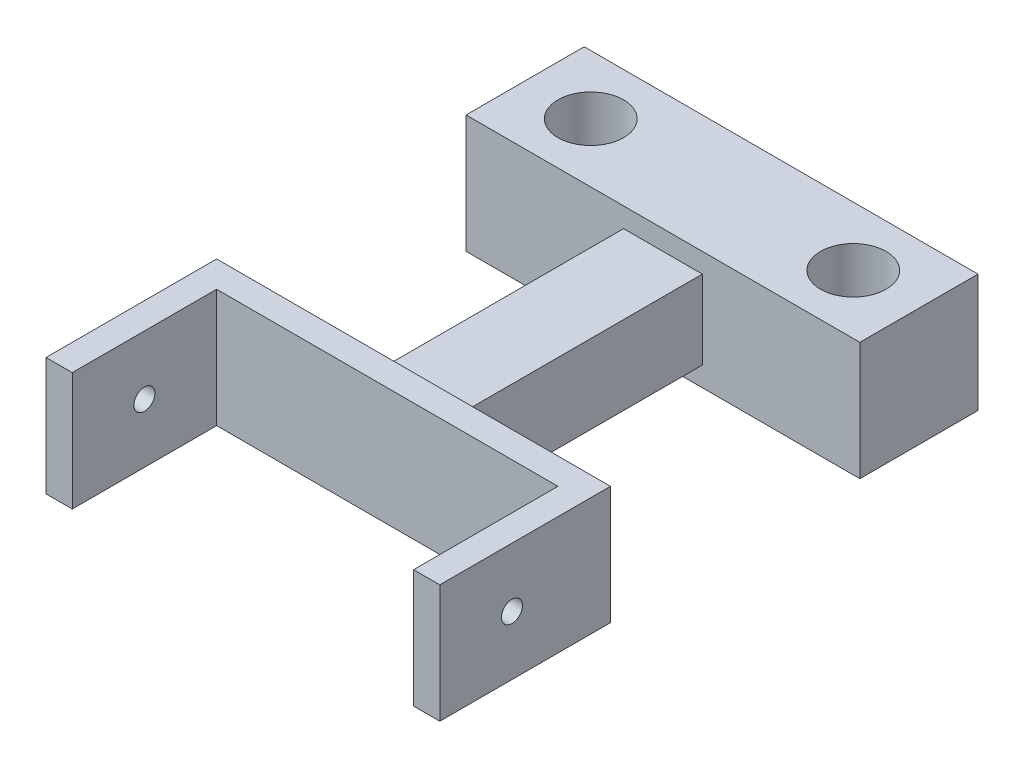
from build123d import *

# Parameters (mm, degrees)
SKETCH_1_W               = 150
SKETCH_1_H               = 45
EXTRUDE_1_DEPTH          = 45
CUT_EXTRUDE_1_DEPTH      = 91.311959341
CUT_EXTRUDE_1_DEPTH_BACK = 91.311959341
SKETCH_2_R               = 12.5
SKETCH_3_W               = 30
SKETCH_3_H               = 30
EXTRUDE_2_DEPTH          = 95
EXTRUDE_3_DEPTH          = 22.5
CUT_EXTRUDE_2_DEPTH      = 179.132675273
CUT_EXTRUDE_2_DEPTH_BACK = 179.132675273
SKETCH_5_R               = 4


with BuildPart() as part:
    # 草图1 → 凸台-拉伸1 (new body)
    with BuildSketch(Plane.XY):
        Rectangle(SKETCH_1_W, SKETCH_1_H)
    extrude(amount=-EXTRUDE_1_DEPTH)

    # 草图2 → 切除-拉伸1 (cut, two sides: drawn at the far end of the back side and taken through both)
    with BuildSketch(Plane(origin=(0, 0, 0), x_dir=(1, 0, 0), z_dir=(0, 1, 0)).offset(-CUT_EXTRUDE_1_DEPTH_BACK)):
        with Locations(Location((-50, 22.5, 0), (0, 0, 270))):
            Circle(SKETCH_2_R)
        with Locations(Location((50, 22.5, 0), (0, 0, 270))):
            Circle(SKETCH_2_R)
    extrude(amount=CUT_EXTRUDE_1_DEPTH + CUT_EXTRUDE_1_DEPTH_BACK, mode=Mode.SUBTRACT)

    # 草图3 → 凸台-拉伸2 (add)
    with BuildSketch(Plane.XY):
        Rectangle(SKETCH_3_W, SKETCH_3_H)
    extrude(amount=EXTRUDE_2_DEPTH)

    # 草图4 → 凸台-拉伸3 (add, symmetric)
    with BuildSketch(Plane(origin=(0, 0, 0), x_dir=(1, 0, 0), z_dir=(0, 1, 0))):
        Polygon((-75, -95), (75, -95), (75, -160), (65, -160), (65, -105), (-65, -105), (-65, -160), (-75, -160), align=None)
    extrude(amount=EXTRUDE_3_DEPTH, both=True)

    # 草图5 → 切除-拉伸2 (cut, two sides: drawn at the far end of the back side and taken through both)
    with BuildSketch(Plane(origin=(0, 0, 0), x_dir=(0, 0, -1), z_dir=(1, 0, 0)).offset(-CUT_EXTRUDE_2_DEPTH_BACK)):
        with Locations((-132.5, 0)):
            Circle(SKETCH_5_R)
    extrude(amount=CUT_EXTRUDE_2_DEPTH + CUT_EXTRUDE_2_DEPTH_BACK, mode=Mode.SUBTRACT)


solid = part.part
